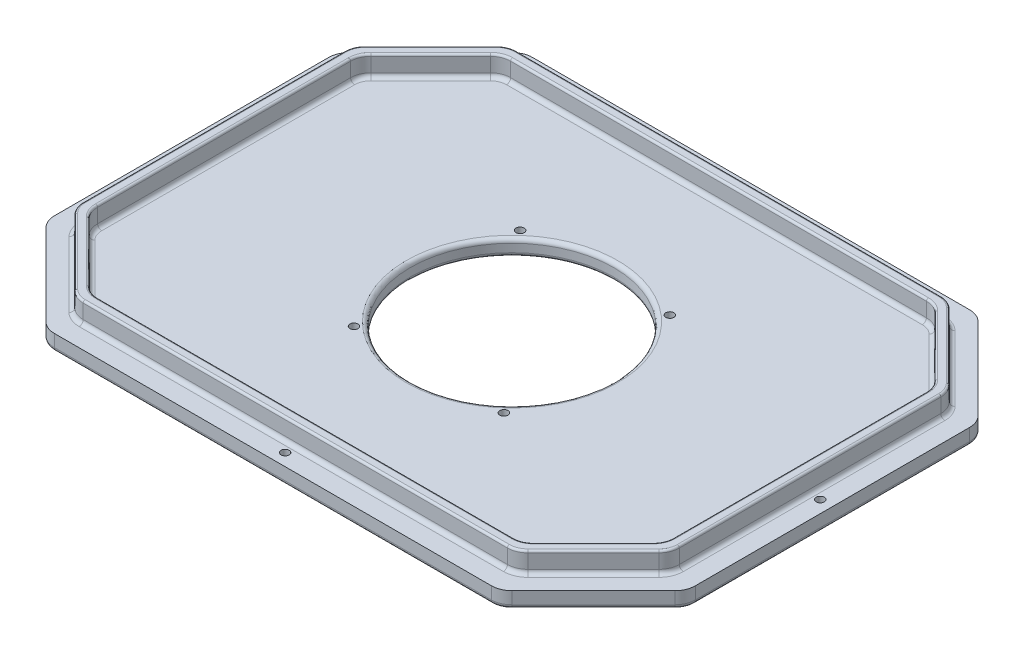
from build123d import *

# Parameters (mm, degrees)
BOSS_EXTRUDE1_DEPTH     = 4
BOSS_EXTRUDE2_DEPTH     = 10
CUT_EXTRUDE1_DEPTH      = 197.7549237
CUT_EXTRUDE1_DEPTH_BACK = 197.7549237
SKETCH3_R               = 2
CUT_EXTRUDE2_DEPTH      = 198.323338711
CUT_EXTRUDE2_DEPTH_BACK = 198.323338711
SKETCH4_R               = 2
SKETCH4_R_2             = 50
FILLET1_R               = 10
FILLET3_R               = 2
FILLET4_R               = 1
FILLET6_R               = 2
FILLET7_R               = 2


with BuildPart() as part:
    # Sketch1 → Boss-Extrude1 (new, symmetric)
    # profile 1 of 2: a face of its own
    with BuildSketch(Plane(origin=(0, 0, 0), x_dir=(1, 0, 0), z_dir=(0, 1, 0))):
        Polygon((-111.538059223, 117.5), (111.538059223, 117.5), (157.5, 71.538059223), (157.5, -71.538059223), (111.538059223, -117.5), (-111.538059223, -117.5), (-157.5, -71.538059223), (-157.5, 71.538059223), align=None)
        Polygon((-108.395923599, -106.5), (108.395923599, -106.5), (146.5, -68.395923599), (146.5, 68.395923599), (108.395923599, 106.5), (-108.395923599, 106.5), (-146.5, 68.395923599), (-146.5, -68.395923599), align=None, mode=Mode.SUBTRACT)
    # profile 2 of 2: a face of its own
    with BuildSketch(Plane(origin=(0, 0, 0), x_dir=(1, 0, 0), z_dir=(0, 1, 0))):
        Polygon((-108.395923599, -106.5), (-146.5, -68.395923599), (-146.5, 68.395923599), (-108.395923599, 106.5), (108.395923599, 106.5), (146.5, 68.395923599), (146.5, -68.395923599), (108.395923599, -106.5), align=None)
    extrude(amount=BOSS_EXTRUDE1_DEPTH, both=True)

    # Sketch2 → Boss-Extrude2 (add)
    with BuildSketch(Plane(origin=(0, 4, 0), x_dir=(1, 0, 0), z_dir=(0, 1, 0))):
        Polygon((108.395923599, 106.5), (146.5, 68.395923599), (146.5, -68.395923599), (108.395923599, -106.5), (-108.395923599, -106.5), (-146.5, -68.395923599), (-146.5, 68.395923599), (-108.395923599, 106.5), align=None)
        Polygon((106.324855787, 101.5), (141.5, 66.324855787), (141.5, -66.324855787), (106.324855787, -101.5), (-106.324855787, -101.5), (-141.5, -66.324855787), (-141.5, 66.324855787), (-106.324855787, 101.5), align=None, mode=Mode.SUBTRACT)
    extrude(amount=BOSS_EXTRUDE2_DEPTH)

    # Sketch3 → Cut-Extrude1 (cut, two sides: drawn at the far end of the back side and taken through both)
    with BuildSketch(Plane(origin=(0, 4, 0), x_dir=(1, 0, 0), z_dir=(0, 1, 0)).offset(-CUT_EXTRUDE1_DEPTH_BACK)):
        with Locations(Location((0, 111.5, 0), (0, 0, 270))):
            Circle(SKETCH3_R)
        with Locations(Location((0, -111.5, 0), (0, 0, 270))):
            Circle(SKETCH3_R)
        with Locations(Location((151.5, 0, 0), (0, 0, 270))):
            Circle(SKETCH3_R)
        with Locations(Location((-151.5, 0, 0), (0, 0, 270))):
            Circle(SKETCH3_R)
    extrude(amount=CUT_EXTRUDE1_DEPTH + CUT_EXTRUDE1_DEPTH_BACK, mode=Mode.SUBTRACT)

    # Sketch4 → Cut-Extrude2 (cut, two sides: drawn at the far end of the back side and taken through both)
    with BuildSketch(Plane.XZ.offset(4).offset(-CUT_EXTRUDE2_DEPTH_BACK)):
        with Locations(Location((-36.842001616, -40.837077723, 0), (0, 0, 270))):
            Circle(SKETCH4_R)
        with Locations(Location((36, -41.581245773, 0), (0, 0, 270))):
            Circle(SKETCH4_R)
        with Locations(Location((-36.842001616, 40.837077723, 0), (0, 0, 270))):
            Circle(SKETCH4_R)
        with Locations(Location((36.842001616, 40.837077723, 0), (0, 0, 270))):
            Circle(SKETCH4_R)
        with Locations(Location((0, 0, 0), (0, 0, 270))):
            Circle(SKETCH4_R_2)
    extrude(amount=CUT_EXTRUDE2_DEPTH + CUT_EXTRUDE2_DEPTH_BACK, mode=Mode.SUBTRACT)

    # Fillet1
    fillet1_edges = [part.edges().sort_by_distance(p)[0] for p in [
        (111.538059223, 0, -117.5),
        (157.5, 0, -71.538059223),
        (157.5, 0, 71.538059223),
        (111.538059223, 0, 117.5),
        (-111.538059223, 0, 117.5),
        (-157.5, 0, 71.538059223),
        (-157.5, 0, -71.538059223),
        (-111.538059223, 0, -117.5),
        (108.395923599, 9, -106.5),
        (-108.395923599, 9, -106.5),
        (-146.5, 9, -68.395923599),
        (-146.5, 9, 68.395923599),
        (-108.395923599, 9, 106.5),
        (108.395923599, 9, 106.5),
        (146.5, 9, 68.395923599),
        (146.5, 9, -68.395923599),
        (-106.324855787, 9, -101.5),
        (-141.5, 9, -66.324855787),
        (-141.5, 9, 66.324855787),
        (-106.324855787, 9, 101.5),
        (106.324855787, 9, 101.5),
        (141.5, 9, 66.324855787),
        (141.5, 9, -66.324855787),
        (106.324855787, 9, -101.5),
    ]]
    fillet(fillet1_edges, radius=FILLET1_R)

    # Fillet3
    fillet3_edges = [part.edges().sort_by_distance(p)[0] for p in [
        (141.5, 4, 0),
        (0, 4, -101.5),
        (-123.912427894, 4, -83.912427894),
        (-141.5, 4, 0),
        (-123.912427894, 4, 83.912427894),
        (0, 4, 101.5),
        (123.912427894, 4, 83.912427894),
        (123.912427894, 4, -83.912427894),
        (-140.738795325, 4, -66.009554487),
        (-106.009554487, 4, -100.738795325),
        (-106.009554487, 4, 100.738795325),
        (-140.738795325, 4, 66.009554487),
        (140.738795325, 4, 66.009554487),
        (106.009554487, 4, 100.738795325),
        (106.009554487, 4, -100.738795325),
        (140.738795325, 4, -66.009554487),
        (127.4479618, 4, 87.4479618),
        (0, 4, 106.5),
        (146.5, 4, 0),
        (127.4479618, 4, -87.4479618),
        (0, 4, -106.5),
        (-127.4479618, 4, -87.4479618),
        (-146.5, 4, 0),
        (-127.4479618, 4, 87.4479618),
        (108.080622299, 4, 105.738795325),
        (145.738795325, 4, 68.080622299),
        (145.738795325, 4, -68.080622299),
        (108.080622299, 4, -105.738795325),
        (-108.080622299, 4, -105.738795325),
        (-145.738795325, 4, -68.080622299),
        (-145.738795325, 4, 68.080622299),
        (-108.080622299, 4, 105.738795325),
    ]]
    fillet(fillet3_edges, radius=FILLET3_R)

    # Fillet4
    fillet4_edges = [part.edges().sort_by_distance(p)[0] for p in [
        (141.5, 14, 0),
        (123.912427894, 14, -83.912427894),
        (0, 14, -101.5),
        (0, 14, 101.5),
        (123.912427894, 14, 83.912427894),
        (-141.5, 14, 0),
        (-123.912427894, 14, 83.912427894),
        (-123.912427894, 14, -83.912427894),
        (127.4479618, 14, 87.4479618),
        (0, 14, 106.5),
        (0, 14, -106.5),
        (-127.4479618, 14, -87.4479618),
        (-146.5, 14, 0),
        (-127.4479618, 14, 87.4479618),
        (146.5, 14, 0),
        (127.4479618, 14, -87.4479618),
        (-108.080622299, 14, 105.738795325),
        (-145.738795325, 14, 68.080622299),
        (-145.738795325, 14, -68.080622299),
        (-108.080622299, 14, -105.738795325),
        (108.080622299, 14, -105.738795325),
        (145.738795325, 14, -68.080622299),
        (145.738795325, 14, 68.080622299),
        (108.080622299, 14, 105.738795325),
        (140.738795325, 14, -66.009554487),
        (106.009554487, 14, -100.738795325),
        (106.009554487, 14, 100.738795325),
        (140.738795325, 14, 66.009554487),
        (-140.738795325, 14, 66.009554487),
        (-106.009554487, 14, 100.738795325),
        (-106.009554487, 14, -100.738795325),
        (-140.738795325, 14, -66.009554487),
    ]]
    fillet(fillet4_edges, radius=FILLET4_R)

    # Fillet6
    fillet6_edges = [part.edges().sort_by_distance(p)[0] for p in [
        (134.519029611, -4, 94.519029611),
        (0, -4, -117.5),
        (134.519029611, -4, -94.519029611),
        (157.5, -4, 0),
        (0, -4, 117.5),
        (-134.519029611, -4, 94.519029611),
        (-157.5, -4, 0),
        (-134.519029611, -4, -94.519029611),
        (111.222757923, -4, -116.738795325),
        (156.738795325, -4, -71.222757923),
        (-111.222757923, -4, -116.738795325),
        (-156.738795325, -4, -71.222757923),
        (-156.738795325, -4, 71.222757923),
        (-111.222757923, -4, 116.738795325),
        (156.738795325, -4, 71.222757923),
        (111.222757923, -4, 116.738795325),
    ]]
    fillet(fillet6_edges, radius=FILLET6_R)

    # Fillet7
    fillet7_edges = [part.edges().sort_by_distance(p)[0] for p in [
        (0, 4, 50),
        (0, -4, 50),
    ]]
    fillet(fillet7_edges, radius=FILLET7_R)


solid = part.part
